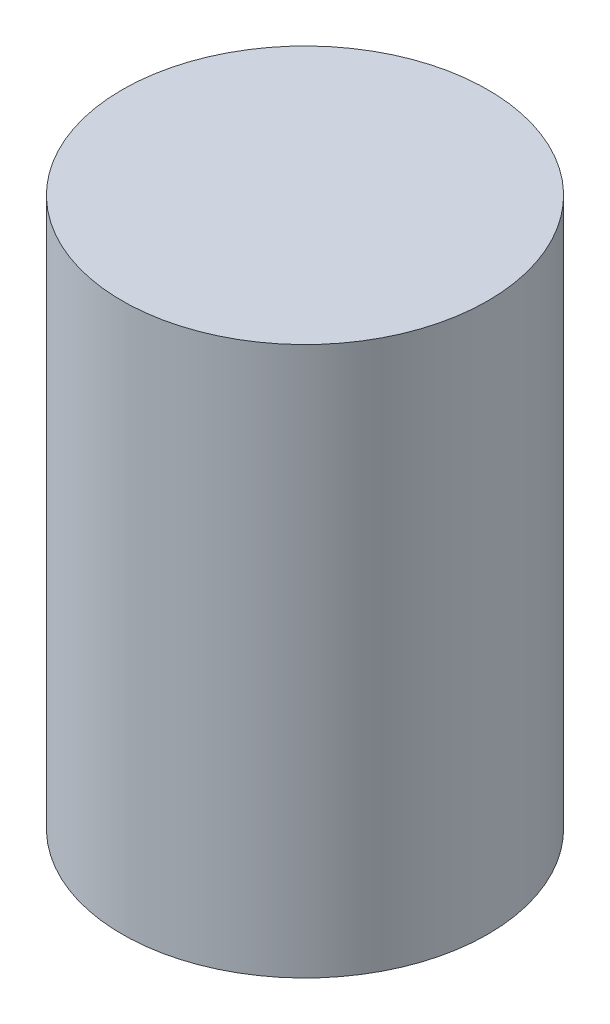
from build123d import *

# Parameters (mm, degrees)
SKETCH1_W = 1000
SKETCH1_H = 3000


with BuildPart() as part:
    # Sketch1 → Revolve1 (revolve)
    with BuildSketch(Plane.XY, mode=Mode.PRIVATE) as revolve1_sk:
        with Locations((500, -750)):
            Rectangle(SKETCH1_W, SKETCH1_H)
    revolve(revolve1_sk.sketch.rotate(Axis((0, 750, 0), (0, -1, 0)), 180), axis=Axis((0, 750, 0), (0, -1, 0)))


solid = part.part
